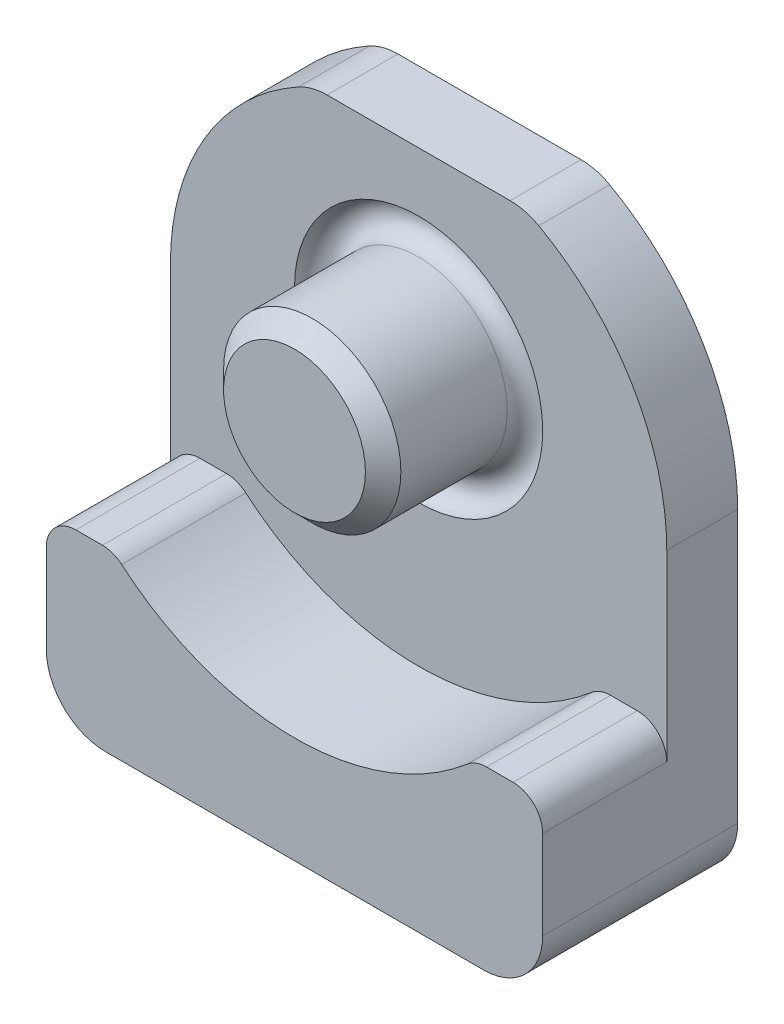
from build123d import *

# Parameters (mm, degrees)
BASIC_DEPTH             = 3.3
BEARING_START           = -2.1
SKETCH2_R               = 1.5
BEARING_CLEARANCE_DEPTH = 2.1
TOP_CLEARANCE_DEPTH     = 8.61905506
FILLET_R1_R             = 1
FILLET_R0_5_R           = 0.5
CHAMFER_R0_3_45_SIZE    = 0.3


with BuildPart() as part:
    # Sketch1 → Basic (new body)
    with BuildSketch(Plane.XY):
        with BuildLine():
            Line((4.2, -0.4), (4.2, -6))
            Line((4.2, -6), (-4.2, -6))
            Line((-4.2, -6), (-4.2, -0.4))
            ThreePointArc((-4.2, -0.4), (0, 3.8), (4.2, -0.4))
        make_face()
    extrude(amount=BASIC_DEPTH)

    # Sketch2 → Bearing Clearance (cut)
    with BuildSketch(Plane.XY.offset(3.3).offset(BEARING_START)):
        with BuildLine():
            Line((-4.2, -3), (-3.059411708, -3))
            ThreePointArc((-3.059411708, -3), (0, -4.2), (3.059411708, -3))
            Line((3.059411708, -3), (4.2, -3))
            Line((4.2, -3), (4.2, -0.4))
            ThreePointArc((4.2, -0.4), (0, 3.8), (-4.2, -0.4))
            Line((-4.2, -0.4), (-4.2, -3))
        make_face()
        with Locations((0, 0.3)):
            Circle(SKETCH2_R, mode=Mode.SUBTRACT)
    extrude(amount=BEARING_CLEARANCE_DEPTH, mode=Mode.SUBTRACT)

    # Sketch3 → Top Clearance (cut, through all)
    with BuildSketch(Plane.XY.offset(1.2)):
        with BuildLine():
            Line((-1.788854382, 3.4), (1.788854382, 3.4))
            ThreePointArc((1.788854382, 3.4), (0, 3.8), (-1.788854382, 3.4))
        make_face()
    extrude(amount=-TOP_CLEARANCE_DEPTH, mode=Mode.SUBTRACT)

    # Sketch7 → Bearing Get Low (revolve, cut)
    with BuildSketch(Plane(origin=(0, 0, 0), x_dir=(0, 0, -1), z_dir=(1, 0, 0)), mode=Mode.PRIVATE) as bearing_get_low_sk:
        with BuildLine():
            Line((-1.2, 1.8), (-1.2, 2.4))
            ThreePointArc((-1.2, 2.4), (-0.9, 2.1), (-1.2, 1.8))
        make_face()
    revolve(bearing_get_low_sk.sketch.rotate(Axis((0, 0.3, 3.3), (0, 0, -1)), 180), axis=Axis((0, 0.3, 3.3), (0, 0, -1)), mode=Mode.SUBTRACT)

    # R1
    fillet_r1_edges = [part.edges().sort_by_distance(p)[0] for p in [
        (-1.788854382, 3.4, 0.6),
        (1.788854382, 3.4, 0.6),
        (-4.2, -6, 1.65),
        (4.2, -6, 1.65),
    ]]
    fillet(fillet_r1_edges, radius=FILLET_R1_R)

    # R0.5
    fillet_r0_5_edges = [part.edges().sort_by_distance(p)[0] for p in [
        (-4.2, -3, 2.25),
        (-3.059411708, -3, 2.25),
        (3.059411708, -3, 2.25),
        (4.2, -3, 2.25),
    ]]
    fillet(fillet_r0_5_edges, radius=FILLET_R0_5_R)

    # R0.3×45°
    chamfer_r0_3_45_edges = [part.edges().sort_by_distance(p)[0] for p in [
        (-1.5, 0.3, 3.3),
    ]]
    chamfer(chamfer_r0_3_45_edges, length=CHAMFER_R0_3_45_SIZE)


solid = part.part
